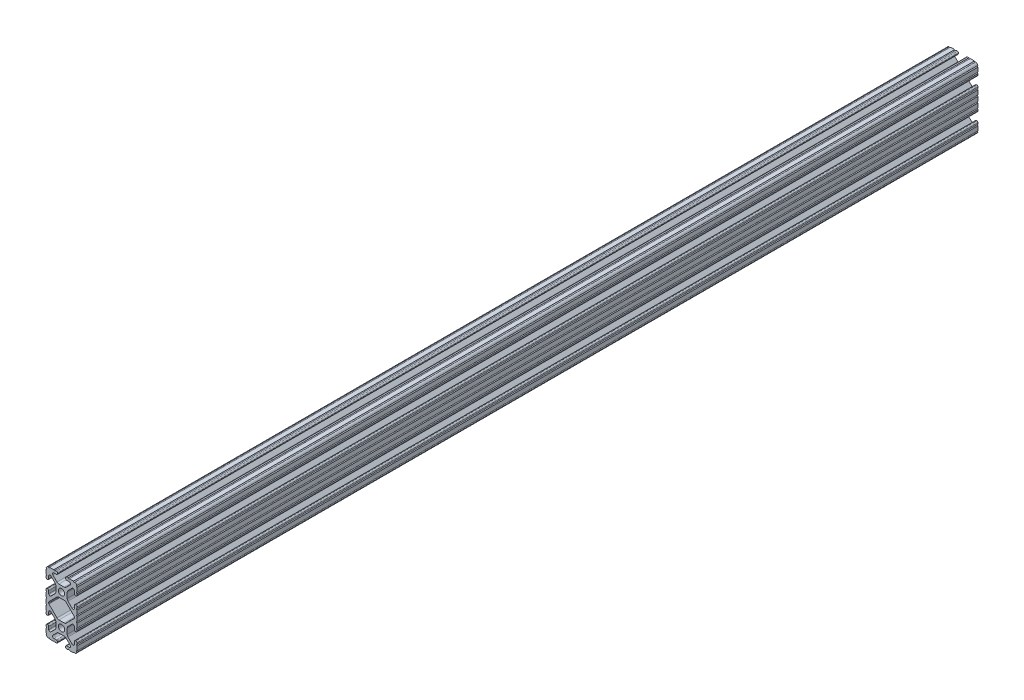
from build123d import *

# Parameters (mm, degrees)
BOSS_EXTRUDE1_DEPTH     = 457.2
CUT_EXTRUDE1_DEPTH      = 459.081095441
CUT_EXTRUDE1_DEPTH_BACK = 459.081095441
SKETCH5_R               = 0.55245
BOSS_EXTRUDE2_DEPTH     = 457.2
CUT_EXTRUDE2_DEPTH      = 459.081095441
CUT_EXTRUDE2_DEPTH_BACK = 459.081095441
SKETCH8_W               = 31.78143374
SKETCH8_H               = 54.190515623
CUT_EXTRUDE3_DEPTH      = 177.8


with BuildPart() as part:
    # Sketch4 → Boss-Extrude1 (new, symmetric)
    with BuildSketch(Plane.XY):
        with BuildLine():
            Line((4.190365, -25.4), (10.11729625, -25.4))
            ThreePointArc((10.11729625, -25.4), (11.943543585, -24.643543585), (12.7, -22.81729625))
            Line((12.7, -22.81729625), (12.7, -16.890365))
            ThreePointArc((12.7, -16.890365), (12.42492494, -16.22627506), (11.760835, -15.9512))
            Line((11.760835, -15.9512), (11.429365, -15.9512))
            ThreePointArc((11.429365, -15.9512), (10.76527506, -16.22627506), (10.4902, -16.890365))
            Line((10.4902, -16.890365), (10.4902, -19.048478019))
            ThreePointArc((10.4902, -19.048478019), (9.830707141, -20.035478831), (8.666460301, -19.803895736))
            Line((8.666460301, -19.803895736), (5.299899128, -16.437334563))
            ThreePointArc((5.299899128, -16.437334563), (4.817571085, -15.715479634), (4.6482, -14.86399369))
            Line((4.6482, -14.86399369), (4.6482, -12.7))
            Line((4.6482, -12.7), (2.6035, -12.7))
            ThreePointArc((2.6035, -12.7), (1.840952505, -14.540952505), (0, -15.3035))
            Line((0, -15.3035), (0, -17.3482))
            Line((0, -17.3482), (2.16399369, -17.3482))
            ThreePointArc((2.16399369, -17.3482), (3.015479634, -17.517571085), (3.737334563, -17.999899128))
            Line((3.737334563, -17.999899128), (7.103895736, -21.366460301))
            ThreePointArc((7.103895736, -21.366460301), (7.335478831, -22.530707141), (6.348478019, -23.1902))
            Line((6.348478019, -23.1902), (4.190365, -23.1902))
            ThreePointArc((4.190365, -23.1902), (3.52627506, -23.46527506), (3.2512, -24.129365))
            Line((3.2512, -24.129365), (3.2512, -24.460835))
            ThreePointArc((3.2512, -24.460835), (3.52627506, -25.12492494), (4.190365, -25.4))
        make_face()
    extrude(amount=BOSS_EXTRUDE1_DEPTH, both=True)

    # Sketch5 → Cut-Extrude1 (cut, two sides: drawn at the far end of the back side and taken through both)
    with BuildSketch(Plane.XY.offset(-CUT_EXTRUDE1_DEPTH_BACK)):
        with Locations((10.356153152, -25.4)):
            Circle(SKETCH5_R)
        with Locations((5.796028019, -25.4)):
            Circle(SKETCH5_R)
        with Locations((12.7, -23.056153152)):
            Circle(SKETCH5_R)
        with Locations((12.7, -18.496028019)):
            Circle(SKETCH5_R)
    extrude(amount=CUT_EXTRUDE1_DEPTH + CUT_EXTRUDE1_DEPTH_BACK, mode=Mode.SUBTRACT)

    # Mirror1: part across plane


with BuildPart() as part_1:
    add(part.part)
    add(part.part.mirror(Plane(origin=(4.6482, -12.7, 457.2), x_dir=(0, 0, 1), z_dir=(0, -1, 0))))

    # Sketch6 → Boss-Extrude2 (add, symmetric)
    with BuildSketch(Plane.XY):
        with BuildLine():
            Line((12.7, -1.791396848), (12.7, 0))
            Line((12.7, 0), (9.803703152, 0))
            Line((9.803703152, 0), (9.803703152, -2.343846848))
            Line((9.803703152, -2.343846848), (12.14755, -2.343846848))
            ThreePointArc((12.14755, -2.343846848), (12.309358859, -1.953205706), (12.7, -1.791396848))
        make_face()
    extrude(amount=BOSS_EXTRUDE2_DEPTH, both=True)

    # Sketch7 → Cut-Extrude2 (cut, two sides: drawn at the far end of the back side and taken through both)
    with BuildSketch(Plane.XY.offset(-CUT_EXTRUDE2_DEPTH_BACK)):
        with BuildLine():
            Line((5.420615149, -5.716820286), (10.328391141, -0.809044294))
            ThreePointArc((10.328391141, -0.809044294), (10.448147248, -0.629816615), (10.4902, -0.418403152))
            Line((10.4902, -0.418403152), (10.4902, 0))
            Line((10.4902, 0), (0, 0))
            Line((0, 0), (5.420615149, -5.716820286))
        make_face()
    extrude(amount=CUT_EXTRUDE2_DEPTH + CUT_EXTRUDE2_DEPTH_BACK, mode=Mode.SUBTRACT)

    # Mirror2: part across plane


with BuildPart() as part_2:
    add(part_1.part)
    add(part_1.part.mirror(Plane.ZX))

    # Mirror3: part across plane


with BuildPart() as part_3:
    add(part_2.part)
    add(part_2.part.mirror(Plane(origin=(0, 0, 0), x_dir=(0, 0, 1), z_dir=(1, 0, 0))))

    # Sketch8 → Cut-Extrude3 (cut)
    with BuildSketch(Plane.XY.offset(457.2)):
        with Locations((0.140937622, -0.634219298)):
            Rectangle(SKETCH8_W, SKETCH8_H)
    extrude(amount=-CUT_EXTRUDE3_DEPTH, mode=Mode.SUBTRACT)


solid = part_3.part
